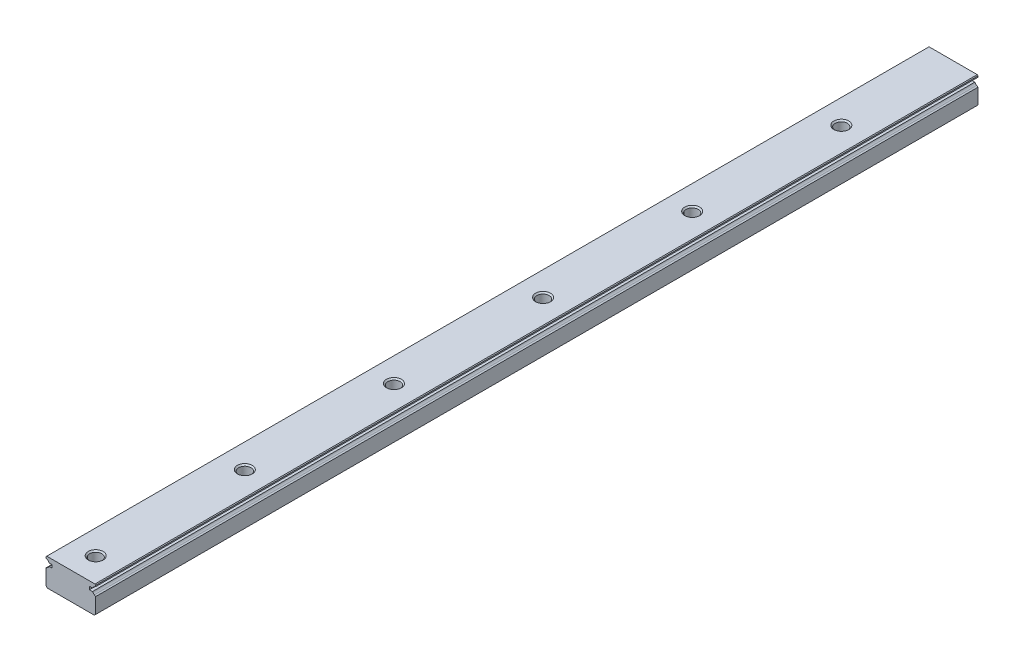
from build123d import *

# Parameters (mm, degrees)
ESQUISSE1_W             = 20
ESQUISSE1_H             = 355
BOSS_EXTRU_1_DEPTH      = 11
ENL_V_MAT_EXTRU_1_DEPTH = 356.311131264
ENL_V_MAT_EXTRU_2_DEPTH = 356.311131264
ENL_V_MAT_EXTRU_3_DEPTH = 356.311131264
ENL_V_MAT_EXTRU_4_DEPTH = 356.311131264
PER_AGE1_D              = 4.917
PER_AGE1_DEPTH          = 11
PER_AGE2_D              = 4.917
CHANFREIN1_SIZE         = 0.5415
CHANFREIN2_SIZE         = 0.3


with BuildPart() as part:
    # Esquisse1 → Boss.-Extru.1 (new body)
    with BuildSketch(Plane.XZ):
        with Locations((0, 72.5)):
            Rectangle(ESQUISSE1_W, ESQUISSE1_H)
    extrude(amount=-BOSS_EXTRU_1_DEPTH)

    # Esquisse2 → Enlèv. mat.-Extru.1 (cut, through all)
    with BuildSketch(Plane(origin=(0, 0, -105), x_dir=(-1, 0, 0), z_dir=(0, 0, -1))):
        with BuildLine():
            Line((10, 7.9), (10, 10.22385))
            Line((10, 10.22385), (9.440021531, 9.900556887))
            ThreePointArc((9.440021531, 9.900556887), (9.015681976, 9.557293765), (8.71772889, 9.1))
            Line((8.71772889, 9.1), (7.5, 9.1))
            Line((7.5, 9.1), (7.5, 7.9))
            Line((7.5, 7.9), (10, 7.9))
        make_face()
    extrude(amount=-ENL_V_MAT_EXTRU_1_DEPTH, mode=Mode.SUBTRACT)

    # Esquisse3 → Enlèv. mat.-Extru.2 (cut, through all)
    with BuildSketch(Plane(origin=(0, 0, -105), x_dir=(-1, 0, 0), z_dir=(0, 0, -1))):
        with BuildLine():
            Line((9.440021531, 7.099443113), (10, 6.77615))
            Line((10, 6.77615), (10, 7.9))
            Line((10, 7.9), (8.71772889, 7.9))
            ThreePointArc((8.71772889, 7.9), (9.015681976, 7.442706235), (9.440021531, 7.099443113))
        make_face()
    extrude(amount=-ENL_V_MAT_EXTRU_2_DEPTH, mode=Mode.SUBTRACT)

    # Esquisse4 → Enlèv. mat.-Extru.3 (cut, through all)
    with BuildSketch(Plane(origin=(0, 0, -105), x_dir=(-1, 0, 0), z_dir=(0, 0, -1))):
        with BuildLine():
            Line((-10, 9.1), (-10, 6.77615))
            Line((-10, 6.77615), (-9.440021531, 7.099443113))
            ThreePointArc((-9.440021531, 7.099443113), (-9.015681976, 7.442706235), (-8.71772889, 7.9))
            Line((-8.71772889, 7.9), (-7.5, 7.9))
            Line((-7.5, 7.9), (-7.5, 9.1))
            Line((-7.5, 9.1), (-10, 9.1))
        make_face()
    extrude(amount=-ENL_V_MAT_EXTRU_3_DEPTH, mode=Mode.SUBTRACT)

    # Esquisse5 → Enlèv. mat.-Extru.4 (cut, through all)
    with BuildSketch(Plane(origin=(0, 0, -105), x_dir=(-1, 0, 0), z_dir=(0, 0, -1))):
        with BuildLine():
            Line((-9.440021531, 9.900556887), (-10, 10.22385))
            Line((-10, 10.22385), (-10, 9.1))
            Line((-10, 9.1), (-8.71772889, 9.1))
            ThreePointArc((-8.71772889, 9.1), (-9.015681976, 9.557293765), (-9.440021531, 9.900556887))
        make_face()
    extrude(amount=-ENL_V_MAT_EXTRU_4_DEPTH, mode=Mode.SUBTRACT)

    # Perçage1
    with Locations(Plane(origin=(0, 11, 0), x_dir=(1, 0, 0), z_dir=(0, 1, 0))):
        with Locations((0, -180), (0, -120), (0, 60), (0, 180)):
            Hole(PER_AGE1_D / 2, depth=PER_AGE1_DEPTH)

    # Perçage2 (through all)
    with Locations(Plane(origin=(0, 0, 0), x_dir=(-1, 0, 0), z_dir=(0, -1, 0))):
        with Locations((0, -240), (0, -60), (0, 0), (0, 120), (0, 240)):
            Hole(PER_AGE2_D / 2)

    # Chanfrein1
    chanfrein1_edges = [part.edges().sort_by_distance(p)[0] for p in [
        (-2.4585, 0, 0),
        (-2.4585, 11, 0),
        (-2.4585, 0, 60),
        (-2.4585, 11, 60),
        (-2.4585, 0, 240),
        (-2.4585, 11, 240),
        (10, 0, 72.5),
        (-10, 0, 72.5),
        (2.4585, 11, -60),
        (2.4585, 0, -60),
        (2.4585, 11, 120),
        (2.4585, 0, 120),
        (2.4585, 11, 180),
        (2.4585, 0, 180),
    ]]
    chamfer(chanfrein1_edges, length=CHANFREIN1_SIZE)

    # Chanfrein2
    chanfrein2_edges = [part.edges().sort_by_distance(p)[0] for p in [
        (10, 11, 72.5),
        (-10, 11, 72.5),
    ]]
    chamfer(chanfrein2_edges, length=CHANFREIN2_SIZE)


solid = part.part
